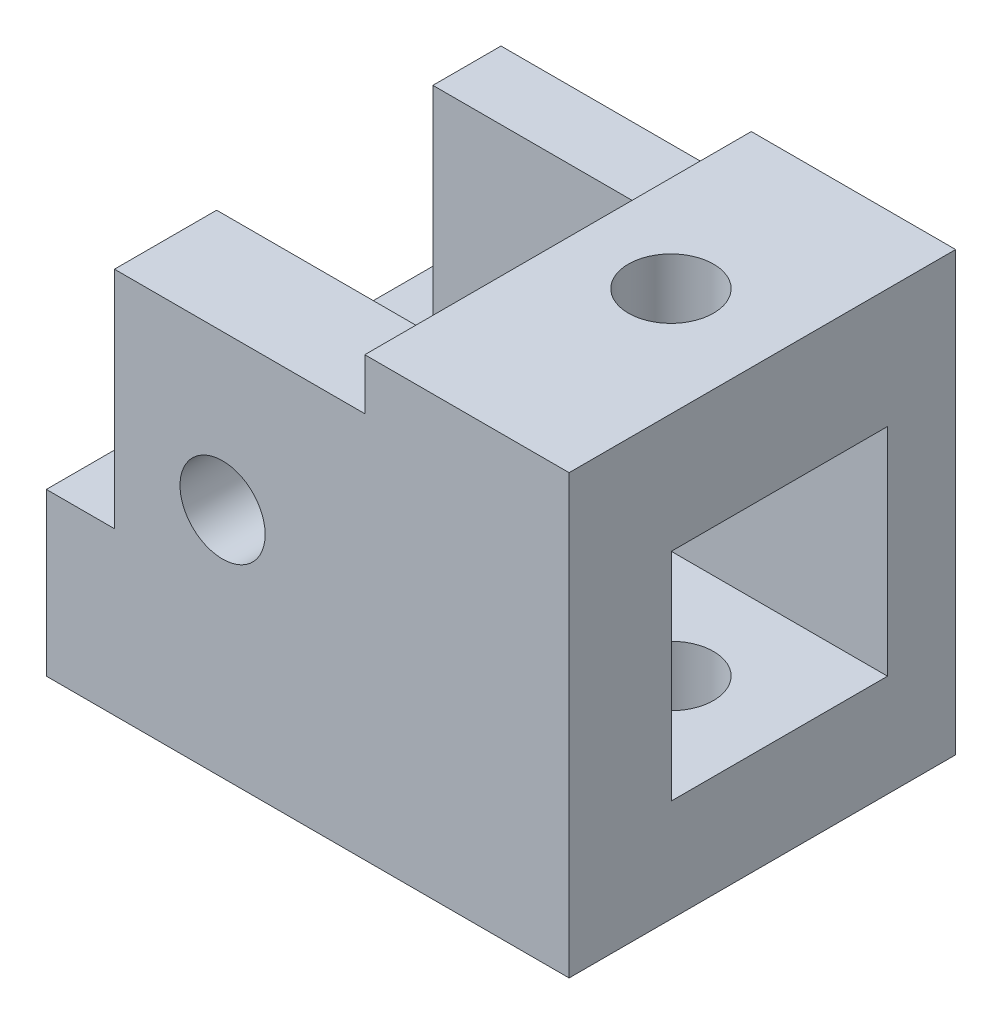
from build123d import *

# Parameters (mm, degrees)
SKETCH_1_W          = 26.7
SKETCH_1_H          = 22.7
EXTRUDE_1_DEPTH     = 6
SKETCH_1_3_W        = 26.7
SKETCH_1_3_H        = 4
SKETCH_1_3_H_2      = 6
EXTRUDE_2_DEPTH     = 12.7
SKETCH_2_R          = 2.5
CUT_EXTRUDE_1_DEPTH = 38.275595233
EXTRUDE_3_DEPTH     = 4
SKETCH_4_R          = 2.5
CUT_EXTRUDE_2_DEPTH = 42.754879954
SKETCH_6_W          = 22.7
SKETCH_6_H          = 9.5
EXTRUDE_4_DEPTH     = 4
EXTRUDE_START       = 3
SKETCH_7_W          = 12
SKETCH_7_H          = 22.7
SKETCH_7_R          = 2.5
EXTRUDE_5_DEPTH     = 3


with BuildPart() as part:
    # 草图1 → 凸台-拉伸1 (new body)
    with BuildSketch(Plane(origin=(0, 0, 0), x_dir=(1, 0, 0), z_dir=(0, 1, 0))):
        with Locations((13.35, 11.35)):
            Rectangle(SKETCH_1_W, SKETCH_1_H)
    extrude(amount=-EXTRUDE_1_DEPTH)

    # 草图1<3> → 凸台-拉伸2 (add)
    with BuildSketch(Plane(origin=(0, 0, 0), x_dir=(1, 0, 0), z_dir=(0, 1, 0))):
        with Locations((13.35, 20.7)):
            Rectangle(SKETCH_1_3_W, SKETCH_1_3_H)
        with Locations((13.35, 3)):
            Rectangle(SKETCH_1_3_W, SKETCH_1_3_H_2)
    extrude(amount=EXTRUDE_2_DEPTH)

    # 草图2 → 切除-拉伸1 (cut, through all)
    with BuildSketch(Plane.XY):
        with Locations((6.35, 7.63)):
            Circle(SKETCH_2_R)
    extrude(amount=-CUT_EXTRUDE_1_DEPTH, mode=Mode.SUBTRACT)

    # 草图3 → 凸台-拉伸3 (add)
    with BuildSketch(Plane(origin=(0, 12.7, 0), x_dir=(1, 0, 0), z_dir=(0, 1, 0))):
        Polygon((0, 22.7), (0, 18.7), (12.7, 18.7), (12.7, 6), (0, 6), (0, 0), (26.7, 0), (26.7, 22.7), align=None)
    extrude(amount=EXTRUDE_3_DEPTH)

    # 草图4 → 切除-拉伸2 (cut, through all)
    with BuildSketch(Plane(origin=(0, 16.7, 0), x_dir=(1, 0, 0), z_dir=(0, 1, 0))):
        with Locations((20.33, 12.35)):
            Circle(SKETCH_4_R)
    extrude(amount=-CUT_EXTRUDE_2_DEPTH, mode=Mode.SUBTRACT)

    # 草图6 → 凸台-拉伸4 (add)
    with BuildSketch(Plane.ZY):
        with Locations((-11.35, -1.25)):
            Rectangle(SKETCH_6_W, SKETCH_6_H)
    extrude(amount=EXTRUDE_4_DEPTH)

    # 草图7 → 凸台-拉伸5 (add)
    with BuildSketch(Plane(origin=(0, 16.7, 0), x_dir=(1, 0, 0), z_dir=(0, 1, 0)).offset(EXTRUDE_START)):
        with Locations((20.7, 11.35)):
            Rectangle(SKETCH_7_W, SKETCH_7_H)
        with Locations((20.33, 12.35)):
            Circle(SKETCH_7_R, mode=Mode.SUBTRACT)
    extrude(amount=-EXTRUDE_5_DEPTH)


solid = part.part
